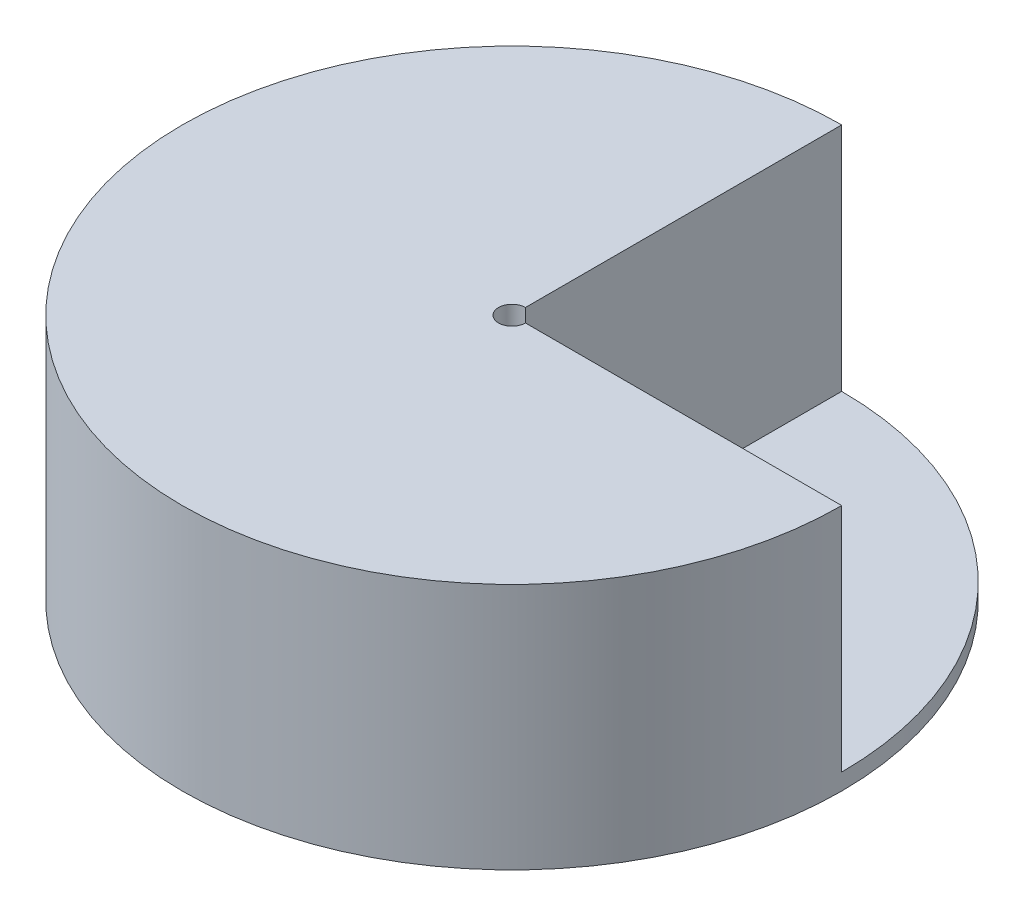
from build123d import *

# Parameters (mm, degrees)
SKETCH5_R           = 20
BOSS_EXTRUDE2_DEPTH = 15
CUT_EXTRUDE1_START  = -14
CUT_EXTRUDE1_DEPTH  = 14
SKETCH7_R           = 0.815
CUT_EXTRUDE2_DEPTH  = 150


with BuildPart() as part:
    # Sketch5 → Boss-Extrude2 (new body)
    with BuildSketch(Plane(origin=(0, 0, 0), x_dir=(1, 0, 0), z_dir=(0, 1, 0))):
        with Locations(Location((0, 0, 0), (0, 0, 270))):
            Circle(SKETCH5_R)
    extrude(amount=BOSS_EXTRUDE2_DEPTH)

    # Sketch6 → Cut-Extrude1 (cut)
    with BuildSketch(Plane(origin=(0, 15, 0), x_dir=(1, 0, 0), z_dir=(0, 1, 0)).offset(CUT_EXTRUDE1_START)):
        with BuildLine():
            Line((0, 20), (0, 0))
            Line((0, 0), (20, 0))
            ThreePointArc((20, 0), (14.142135624, 14.142135624), (0, 20))
        make_face()
    extrude(amount=CUT_EXTRUDE1_DEPTH, mode=Mode.SUBTRACT)

    # Sketch7 → Cut-Extrude2 (cut)
    with BuildSketch(Plane(origin=(0, 15, 0), x_dir=(1, 0, 0), z_dir=(0, 1, 0))):
        with Locations(Location((0, 0, 0), (0, 0, 270))):
            Circle(SKETCH7_R)
    extrude(amount=-CUT_EXTRUDE2_DEPTH, mode=Mode.SUBTRACT)


solid = part.part
